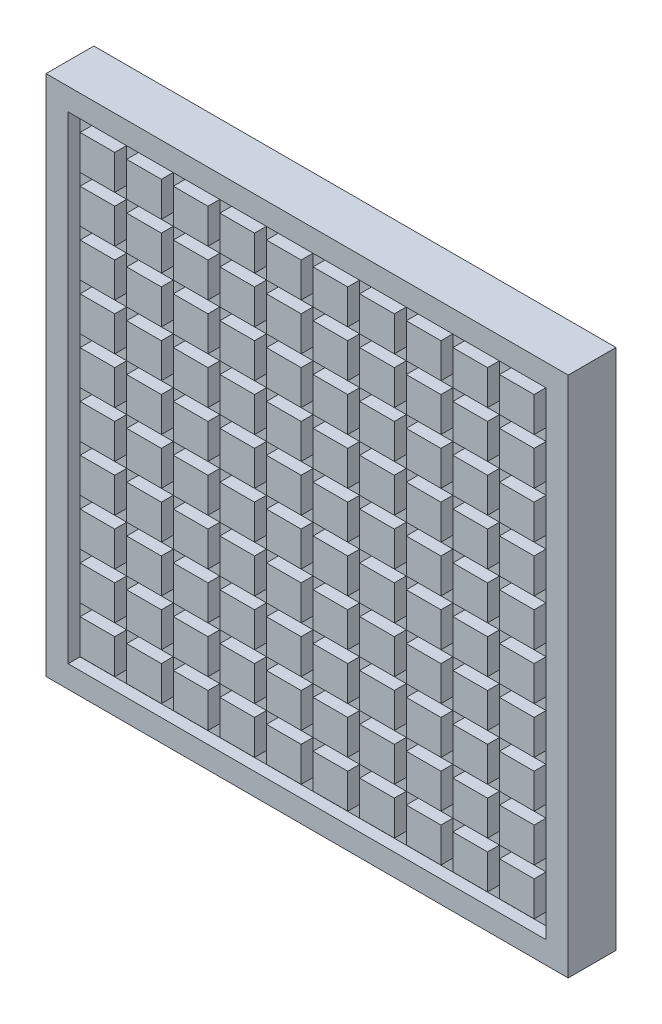
from build123d import *

# Parameters (mm, degrees)
SKETCH_1_W          = 437
SKETCH_1_H          = 437
EXTRUDE_1_DEPTH     = 40
SKETCH_3_W          = 400
SKETCH_3_H          = 400
CUT_EXTRUDE_1_DEPTH = 10
SKETCH_4_W          = 29
SKETCH_4_H          = 29
EXTRUDE_2_DEPTH     = 10


with BuildPart() as part:
    # 草图1 → 凸台-拉伸1 (new body)
    with BuildSketch(Plane.XY):
        with Locations((218.5, 218.5)):
            Rectangle(SKETCH_1_W, SKETCH_1_H)
    extrude(amount=EXTRUDE_1_DEPTH)

    # 草图3 → 切除-拉伸1 (cut)
    with BuildSketch(Plane.XY.offset(40)):
        with Locations((218.5, 218.5)):
            Rectangle(SKETCH_3_W, SKETCH_3_H)
    extrude(amount=-CUT_EXTRUDE_1_DEPTH, mode=Mode.SUBTRACT)

    # 草图4 → 凸台-拉伸2 (add)
    with BuildSketch(Plane.XY.offset(30)):
        with Locations((82, 394.128297888)):
            Rectangle(SKETCH_4_W, SKETCH_4_H)
        with Locations((43, 394.128297888)):
            Rectangle(SKETCH_4_W, SKETCH_4_H)
        with Locations((121, 394.128297888)):
            Rectangle(SKETCH_4_W, SKETCH_4_H)
        with Locations((160, 394.128297888)):
            Rectangle(SKETCH_4_W, SKETCH_4_H)
        with Locations((199, 394.128297888)):
            Rectangle(SKETCH_4_W, SKETCH_4_H)
        with Locations((238, 394.128297888)):
            Rectangle(SKETCH_4_W, SKETCH_4_H)
        with Locations((277, 394.128297888)):
            Rectangle(SKETCH_4_W, SKETCH_4_H)
        with Locations((316, 394.128297888)):
            Rectangle(SKETCH_4_W, SKETCH_4_H)
        with Locations((355, 394.128297888)):
            Rectangle(SKETCH_4_W, SKETCH_4_H)
        with Locations((394, 394.128297888)):
            Rectangle(SKETCH_4_W, SKETCH_4_H)
        with Locations((82, 355.128297888)):
            Rectangle(SKETCH_4_W, SKETCH_4_H)
        with Locations((121, 355.128297888)):
            Rectangle(SKETCH_4_W, SKETCH_4_H)
        with Locations((160, 355.128297888)):
            Rectangle(SKETCH_4_W, SKETCH_4_H)
        with Locations((199, 355.128297888)):
            Rectangle(SKETCH_4_W, SKETCH_4_H)
        with Locations((238, 355.128297888)):
            Rectangle(SKETCH_4_W, SKETCH_4_H)
        with Locations((277, 355.128297888)):
            Rectangle(SKETCH_4_W, SKETCH_4_H)
        with Locations((316, 355.128297888)):
            Rectangle(SKETCH_4_W, SKETCH_4_H)
        with Locations((355, 355.128297888)):
            Rectangle(SKETCH_4_W, SKETCH_4_H)
        with Locations((394, 355.128297888)):
            Rectangle(SKETCH_4_W, SKETCH_4_H)
        with Locations((82, 316.128297888)):
            Rectangle(SKETCH_4_W, SKETCH_4_H)
        with Locations((121, 316.128297888)):
            Rectangle(SKETCH_4_W, SKETCH_4_H)
        with Locations((160, 316.128297888)):
            Rectangle(SKETCH_4_W, SKETCH_4_H)
        with Locations((199, 316.128297888)):
            Rectangle(SKETCH_4_W, SKETCH_4_H)
        with Locations((238, 316.128297888)):
            Rectangle(SKETCH_4_W, SKETCH_4_H)
        with Locations((277, 316.128297888)):
            Rectangle(SKETCH_4_W, SKETCH_4_H)
        with Locations((316, 316.128297888)):
            Rectangle(SKETCH_4_W, SKETCH_4_H)
        with Locations((355, 316.128297888)):
            Rectangle(SKETCH_4_W, SKETCH_4_H)
        with Locations((394, 316.128297888)):
            Rectangle(SKETCH_4_W, SKETCH_4_H)
        with Locations((82, 277.128297888)):
            Rectangle(SKETCH_4_W, SKETCH_4_H)
        with Locations((121, 277.128297888)):
            Rectangle(SKETCH_4_W, SKETCH_4_H)
        with Locations((160, 277.128297888)):
            Rectangle(SKETCH_4_W, SKETCH_4_H)
        with Locations((199, 277.128297888)):
            Rectangle(SKETCH_4_W, SKETCH_4_H)
        with Locations((238, 277.128297888)):
            Rectangle(SKETCH_4_W, SKETCH_4_H)
        with Locations((277, 277.128297888)):
            Rectangle(SKETCH_4_W, SKETCH_4_H)
        with Locations((316, 277.128297888)):
            Rectangle(SKETCH_4_W, SKETCH_4_H)
        with Locations((355, 277.128297888)):
            Rectangle(SKETCH_4_W, SKETCH_4_H)
        with Locations((394, 277.128297888)):
            Rectangle(SKETCH_4_W, SKETCH_4_H)
        with Locations((82, 238.128297888)):
            Rectangle(SKETCH_4_W, SKETCH_4_H)
        with Locations((121, 238.128297888)):
            Rectangle(SKETCH_4_W, SKETCH_4_H)
        with Locations((160, 238.128297888)):
            Rectangle(SKETCH_4_W, SKETCH_4_H)
        with Locations((199, 238.128297888)):
            Rectangle(SKETCH_4_W, SKETCH_4_H)
        with Locations((238, 238.128297888)):
            Rectangle(SKETCH_4_W, SKETCH_4_H)
        with Locations((277, 238.128297888)):
            Rectangle(SKETCH_4_W, SKETCH_4_H)
        with Locations((316, 238.128297888)):
            Rectangle(SKETCH_4_W, SKETCH_4_H)
        with Locations((355, 238.128297888)):
            Rectangle(SKETCH_4_W, SKETCH_4_H)
        with Locations((394, 238.128297888)):
            Rectangle(SKETCH_4_W, SKETCH_4_H)
        with Locations((82, 199.128297888)):
            Rectangle(SKETCH_4_W, SKETCH_4_H)
        with Locations((121, 199.128297888)):
            Rectangle(SKETCH_4_W, SKETCH_4_H)
        with Locations((160, 199.128297888)):
            Rectangle(SKETCH_4_W, SKETCH_4_H)
        with Locations((199, 199.128297888)):
            Rectangle(SKETCH_4_W, SKETCH_4_H)
        with Locations((238, 199.128297888)):
            Rectangle(SKETCH_4_W, SKETCH_4_H)
        with Locations((277, 199.128297888)):
            Rectangle(SKETCH_4_W, SKETCH_4_H)
        with Locations((316, 199.128297888)):
            Rectangle(SKETCH_4_W, SKETCH_4_H)
        with Locations((355, 199.128297888)):
            Rectangle(SKETCH_4_W, SKETCH_4_H)
        with Locations((394, 199.128297888)):
            Rectangle(SKETCH_4_W, SKETCH_4_H)
        with Locations((82, 160.128297888)):
            Rectangle(SKETCH_4_W, SKETCH_4_H)
        with Locations((121, 160.128297888)):
            Rectangle(SKETCH_4_W, SKETCH_4_H)
        with Locations((160, 160.128297888)):
            Rectangle(SKETCH_4_W, SKETCH_4_H)
        with Locations((199, 160.128297888)):
            Rectangle(SKETCH_4_W, SKETCH_4_H)
        with Locations((238, 160.128297888)):
            Rectangle(SKETCH_4_W, SKETCH_4_H)
        with Locations((277, 160.128297888)):
            Rectangle(SKETCH_4_W, SKETCH_4_H)
        with Locations((316, 160.128297888)):
            Rectangle(SKETCH_4_W, SKETCH_4_H)
        with Locations((355, 160.128297888)):
            Rectangle(SKETCH_4_W, SKETCH_4_H)
        with Locations((394, 160.128297888)):
            Rectangle(SKETCH_4_W, SKETCH_4_H)
        with Locations((82, 121.128297888)):
            Rectangle(SKETCH_4_W, SKETCH_4_H)
        with Locations((121, 121.128297888)):
            Rectangle(SKETCH_4_W, SKETCH_4_H)
        with Locations((160, 121.128297888)):
            Rectangle(SKETCH_4_W, SKETCH_4_H)
        with Locations((199, 121.128297888)):
            Rectangle(SKETCH_4_W, SKETCH_4_H)
        with Locations((238, 121.128297888)):
            Rectangle(SKETCH_4_W, SKETCH_4_H)
        with Locations((277, 121.128297888)):
            Rectangle(SKETCH_4_W, SKETCH_4_H)
        with Locations((316, 121.128297888)):
            Rectangle(SKETCH_4_W, SKETCH_4_H)
        with Locations((355, 121.128297888)):
            Rectangle(SKETCH_4_W, SKETCH_4_H)
        with Locations((394, 121.128297888)):
            Rectangle(SKETCH_4_W, SKETCH_4_H)
        with Locations((82, 82.128297888)):
            Rectangle(SKETCH_4_W, SKETCH_4_H)
        with Locations((121, 82.128297888)):
            Rectangle(SKETCH_4_W, SKETCH_4_H)
        with Locations((160, 82.128297888)):
            Rectangle(SKETCH_4_W, SKETCH_4_H)
        with Locations((199, 82.128297888)):
            Rectangle(SKETCH_4_W, SKETCH_4_H)
        with Locations((238, 82.128297888)):
            Rectangle(SKETCH_4_W, SKETCH_4_H)
        with Locations((277, 82.128297888)):
            Rectangle(SKETCH_4_W, SKETCH_4_H)
        with Locations((316, 82.128297888)):
            Rectangle(SKETCH_4_W, SKETCH_4_H)
        with Locations((355, 82.128297888)):
            Rectangle(SKETCH_4_W, SKETCH_4_H)
        with Locations((394, 82.128297888)):
            Rectangle(SKETCH_4_W, SKETCH_4_H)
        with Locations((82, 43.128297888)):
            Rectangle(SKETCH_4_W, SKETCH_4_H)
        with Locations((121, 43.128297888)):
            Rectangle(SKETCH_4_W, SKETCH_4_H)
        with Locations((160, 43.128297888)):
            Rectangle(SKETCH_4_W, SKETCH_4_H)
        with Locations((199, 43.128297888)):
            Rectangle(SKETCH_4_W, SKETCH_4_H)
        with Locations((238, 43.128297888)):
            Rectangle(SKETCH_4_W, SKETCH_4_H)
        with Locations((277, 43.128297888)):
            Rectangle(SKETCH_4_W, SKETCH_4_H)
        with Locations((316, 43.128297888)):
            Rectangle(SKETCH_4_W, SKETCH_4_H)
        with Locations((355, 43.128297888)):
            Rectangle(SKETCH_4_W, SKETCH_4_H)
        with Locations((394, 43.128297888)):
            Rectangle(SKETCH_4_W, SKETCH_4_H)
        with Locations((43, 355.128297888)):
            Rectangle(SKETCH_4_W, SKETCH_4_H)
        with Locations((43, 316.128297888)):
            Rectangle(SKETCH_4_W, SKETCH_4_H)
        with Locations((43, 277.128297888)):
            Rectangle(SKETCH_4_W, SKETCH_4_H)
        with Locations((43, 238.128297888)):
            Rectangle(SKETCH_4_W, SKETCH_4_H)
        with Locations((43, 199.128297888)):
            Rectangle(SKETCH_4_W, SKETCH_4_H)
        with Locations((43, 160.128297888)):
            Rectangle(SKETCH_4_W, SKETCH_4_H)
        with Locations((43, 121.128297888)):
            Rectangle(SKETCH_4_W, SKETCH_4_H)
        with Locations((43, 82.128297888)):
            Rectangle(SKETCH_4_W, SKETCH_4_H)
        with Locations((43, 43.128297888)):
            Rectangle(SKETCH_4_W, SKETCH_4_H)
    extrude(amount=EXTRUDE_2_DEPTH)


solid = part.part
